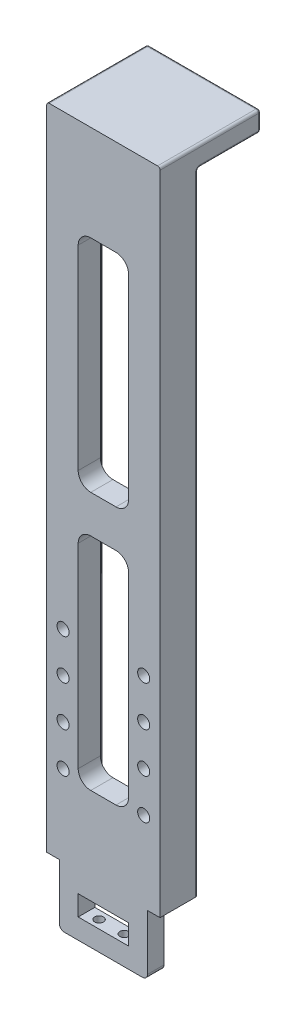
from build123d import *

# Parameters (mm, degrees)
RUNDUNG_DEPTH                   = 250
SKIZZE2_W                       = 22
SKIZZE2_H                       = 3.270726357
AUSSPARUNGLAUF_DEPTH            = 252.122480077
SKIZZE4_W                       = 20
SKIZZE4_H                       = 87.5
SCHNITT_LINEAR_AUSTRAGEN2_DEPTH = 252.164667101
SKIZZE5_R                       = 2.4
SCHNITT_LINEAR_AUSTRAGEN4_DEPTH = 6.4
SKIZZE6_R                       = 2.85
SCHNITT_LINEAR_AUSTRAGEN5_DEPTH = 1
SKIZZE9_W                       = 35
SKIZZE9_H                       = 6.605082277
AUFSATZ_LINEAR_AUSTRAGEN1_DEPTH = 24
SKIZZE10_W                      = 20
SKIZZE10_H                      = 8
SCHNITT_LINEAR_AUSTRAGEN7_DEPTH = 24
SCHNITT_LINEAR_AUSTRAGEN8_REACH = 277.025
SKIZZE11_R                      = 1.75
SKIZZE12_W                      = 45
SKIZZE12_H                      = 40
AUFSATZ_LINEAR_AUSTRAGEN2_DEPTH = 8
VERRUNDUNG1_R                   = 5
VERRUNDUNG6_R                   = 1
VERRUNDUNG7_R                   = 1
VERRUNDUNG8_R                   = 2


with BuildPart() as part:
    # Skizze1 → Rundung (new body)
    with BuildSketch(Plane(origin=(0, 0, 0), x_dir=(1, 0, 0), z_dir=(0, 1, 0))):
        with BuildLine():
            Line((-19.158288024, 7.5), (-22.5, 7.5))
            Line((-22.5, 7.5), (-22.5, -7.5))
            Line((-22.5, -7.5), (22.5, -7.5))
            Line((22.5, -7.5), (22.5, 7.5))
            Line((22.5, 7.5), (19.158288024, 7.5))
            ThreePointArc((19.158288024, 7.5), (0, 1.3), (-19.158288024, 7.5))
        make_face()
    extrude(amount=RUNDUNG_DEPTH)

    # Skizze2 → AussparungLauf (cut, through all)
    with BuildSketch(Plane(origin=(0, 250, 0), x_dir=(1, 0, 0), z_dir=(0, 1, 0))):
        with Locations((0, 2.935363178)):
            Rectangle(SKIZZE2_W, SKIZZE2_H)
    extrude(amount=-AUSSPARUNGLAUF_DEPTH, mode=Mode.SUBTRACT)

    # Skizze4 → Schnitt-Linear austragen2 (cut, through all)
    with BuildSketch(Plane(origin=(0, 0, -1.3), x_dir=(-1, 0, 0), z_dir=(0, 0, -1))):
        with Locations((0, 73.75)):
            Rectangle(SKIZZE4_W, SKIZZE4_H)
        with Locations((0, 176.25)):
            Rectangle(SKIZZE4_W, SKIZZE4_H)
    extrude(amount=-SCHNITT_LINEAR_AUSTRAGEN2_DEPTH, mode=Mode.SUBTRACT)

    # Skizze5 → Schnitt-Linear austragen4 (cut)
    with BuildSketch(Plane.XY.offset(7.5)):
        with Locations((-16, 32)):
            Circle(SKIZZE5_R)
        with Locations((16, 32)):
            Circle(SKIZZE5_R)
        with Locations((16, 48)):
            Circle(SKIZZE5_R)
        with Locations((16, 64)):
            Circle(SKIZZE5_R)
        with Locations((16, 80)):
            Circle(SKIZZE5_R)
        with Locations((-16, 48)):
            Circle(SKIZZE5_R)
        with Locations((-16, 64)):
            Circle(SKIZZE5_R)
        with Locations((-16, 80)):
            Circle(SKIZZE5_R)
    extrude(amount=-SCHNITT_LINEAR_AUSTRAGEN4_DEPTH, mode=Mode.SUBTRACT)

    # Skizze6 → Schnitt-Linear austragen5 (cut)
    with BuildSketch(Plane.XY.offset(1.1)):
        with Locations((-16, 32)):
            Circle(SKIZZE6_R)
        with Locations((16, 32)):
            Circle(SKIZZE6_R)
        with Locations((16, 48)):
            Circle(SKIZZE6_R)
        with Locations((16, 64)):
            Circle(SKIZZE6_R)
        with Locations((16, 80)):
            Circle(SKIZZE6_R)
        with Locations((-16, 48)):
            Circle(SKIZZE6_R)
        with Locations((-16, 64)):
            Circle(SKIZZE6_R)
        with Locations((-16, 80)):
            Circle(SKIZZE6_R)
    extrude(amount=-SCHNITT_LINEAR_AUSTRAGEN5_DEPTH, mode=Mode.SUBTRACT)

    # Skizze9 → Aufsatz-Linear austragen1 (add)
    with BuildSketch(Plane.XZ):
        with Locations((0, 4.197458862)):
            Rectangle(SKIZZE9_W, SKIZZE9_H)
    extrude(amount=AUFSATZ_LINEAR_AUSTRAGEN1_DEPTH)

    # Skizze10 → Schnitt-Linear austragen7 (cut)
    with BuildSketch(Plane.XY.offset(7.5)):
        with Locations((0, -12)):
            Rectangle(SKIZZE10_W, SKIZZE10_H)
    extrude(amount=-SCHNITT_LINEAR_AUSTRAGEN7_DEPTH, mode=Mode.SUBTRACT)

    # Skizze11 → Schnitt-Linear austragen8 (cut, up to next)
    with BuildSketch(Plane.XZ.offset(24), mode=Mode.PRIVATE) as schnitt_linear_austragen8_sk1:
        with Locations(Location((-5, 4.197458861, 0), (0, 0, 270))):
            Circle(SKIZZE11_R)
    schnitt_linear_austragen8_tool1 = extrude(schnitt_linear_austragen8_sk1.sketch, amount=-SCHNITT_LINEAR_AUSTRAGEN8_REACH, mode=Mode.PRIVATE) & part.part
    # Skizze11 → Schnitt-Linear austragen8 (cut, up to next)
    with BuildSketch(Plane.XZ.offset(24), mode=Mode.PRIVATE) as schnitt_linear_austragen8_sk2:
        with Locations((5, 4.197458861)):
            Circle(SKIZZE11_R)
    schnitt_linear_austragen8_tool2 = extrude(schnitt_linear_austragen8_sk2.sketch, amount=-SCHNITT_LINEAR_AUSTRAGEN8_REACH, mode=Mode.PRIVATE) & part.part
    add(schnitt_linear_austragen8_tool1.solids().sort_by_distance((-5, -24, 4.197459))[0], mode=Mode.SUBTRACT)
    add(schnitt_linear_austragen8_tool2.solids().sort_by_distance((5, -24, 4.197459))[0], mode=Mode.SUBTRACT)

    # Skizze12 → Aufsatz-Linear austragen2 (add)
    with BuildSketch(Plane(origin=(0, 250, 0), x_dir=(1, 0, 0), z_dir=(0, 1, 0))):
        with Locations((0, 12.5)):
            Rectangle(SKIZZE12_W, SKIZZE12_H)
    extrude(amount=AUFSATZ_LINEAR_AUSTRAGEN2_DEPTH)

    # Verrundung1
    verrundung1_edges = [part.edges().sort_by_distance(p)[0] for p in [
        (10, 132.5, 3.1),
        (10, 220, 3.1),
        (-10, 220, 3.1),
        (-10, 132.5, 3.1),
        (10, 30, 3.1),
        (10, 117.5, 3.1),
        (-10, 117.5, 3.1),
        (-10, 30, 3.1),
    ]]
    fillet(verrundung1_edges, radius=VERRUNDUNG1_R)

    # Verrundung6
    verrundung6_edges = [part.edges().sort_by_distance(p)[0] for p in [
        (-20.829144012, 250, -7.5),
        (15.231246671, 250, -5.063878545),
        (0, 250, -1.3),
        (11, 250, -2.252841171),
        (-11, 125, -3.205682342),
        (-11, 250, -2.252841171),
        (20.829144012, 250, -7.5),
        (-15.231246671, 250, -5.063878545),
    ]]
    fillet(verrundung6_edges, radius=VERRUNDUNG6_R)

    # Verrundung7
    verrundung7_edges = [part.edges().sort_by_distance(p)[0] for p in [
        (0, 250, -32.5),
        (22.5, 254, -32.5),
        (-22.5, 250, -20.5),
        (-22.5, 254, -32.5),
        (22.5, 258, -12.5),
        (0, 258, -32.5),
        (-22.5, 258, -12.5),
        (22.5, 250, -20.5),
        (22.5, 124.5, -7.5),
        (-22.5, 124.5, -7.5),
        (22.5, 249.707106781, -7.792893219),
        (-22.5, 249.707106781, -7.792893219),
    ]]
    fillet(verrundung7_edges, radius=VERRUNDUNG7_R)

    # Verrundung8
    verrundung8_edges = [part.edges().sort_by_distance(p)[0] for p in [
        (-17.5, -24, 4.197458861),
        (17.5, -24, 4.197458861),
    ]]
    fillet(verrundung8_edges, radius=VERRUNDUNG8_R)


solid = part.part
